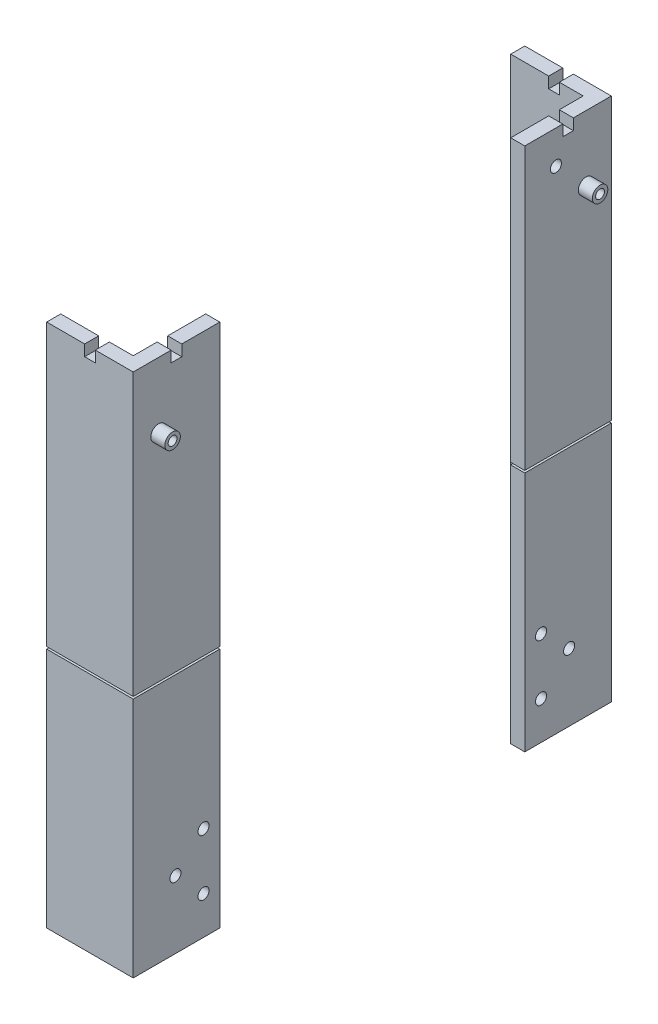
from build123d import *

# Parameters (mm, degrees)
SKETCH1_W                   = 32.730904613
SKETCH1_H                   = 237
BOSS_EXTRUDE1_DEPTH         = 6.35
SKETCH2_W                   = 39.08
SKETCH2_H                   = 237
BOSS_EXTRUDE3_DEPTH         = 6.35
SKETCH27_W                  = 4.8
SKETCH27_H                  = 5
LOCKING_MECHANISM_CUT_DEPTH = 6.35
SKETCH28_R                  = 2.5
BRACKET_BOLT_HOLES_DEPTH    = 6.35
F_1_MM_SPLIT_REACH          = 244.42
SKETCH29_W                  = 39.08
SKETCH29_H                  = 1
SKETCH32_R                  = 3.5
LOCKING_MOUNT_DEPTH         = 6.35
SKETCH33_R                  = 2
M4_SCREW_HOLE_DEPTH         = 6.35
SKETCH35_R                  = 2.5
CUT_EXTRUDE2_DEPTH          = 6.35


with BuildPart() as part:
    # Sketch1 → Boss-Extrude1 (new body)
    with BuildSketch(Plane.XY):
        with Locations((-16.365452306, 118.5)):
            Rectangle(SKETCH1_W, SKETCH1_H)
    extrude(amount=BOSS_EXTRUDE1_DEPTH)

    # Sketch2 → Boss-Extrude3 (add)
    with BuildSketch(Plane(origin=(0, 0, 0), x_dir=(0, 0, -1), z_dir=(1, 0, 0))):
        with Locations((13.19, 118.5)):
            Rectangle(SKETCH2_W, SKETCH2_H)
    extrude(amount=BOSS_EXTRUDE3_DEPTH)

    # Sketch27 → Locking_Mechanism_Cut (cut)
    with BuildSketch(Plane(origin=(6.35, 0, 0), x_dir=(0, 0, -1), z_dir=(1, 0, 0))):
        with Locations((13.180415796, 234.5)):
            Rectangle(SKETCH27_W, SKETCH27_H)
    locking_mechanism_cut = extrude(amount=-LOCKING_MECHANISM_CUT_DEPTH, mode=Mode.SUBTRACT)

    # Sketch28 → Bracket Bolt Holes (cut)
    with BuildSketch(Plane(origin=(6.35, 0, 0), x_dir=(0, 0, -1), z_dir=(1, 0, 0))):
        with Locations((25.4, 42.545)):
            Circle(SKETCH28_R)
        with Locations((25.4, 17.145)):
            Circle(SKETCH28_R)
        with Locations((12.7, 30.48)):
            Circle(SKETCH28_R)
    extrude(amount=-BRACKET_BOLT_HOLES_DEPTH, mode=Mode.SUBTRACT)

    # 1 mm split: up to this face of the body (flat: up to its plane)
    f_1_mm_split_end = Plane(part.part.faces().sort_by_distance((-32.730904613, 118.5, 3.175))[0])
    # Sketch29 → 1 mm split (cut, up to the picked face)
    with BuildSketch(Plane(origin=(6.35, 0, 0), x_dir=(0, 0, -1), z_dir=(1, 0, 0)), mode=Mode.PRIVATE) as f_1_mm_split_sk1:
        with Locations((13.19, 109.586886099)):
            Rectangle(SKETCH29_W, SKETCH29_H)
    f_1_mm_split_tool1 = split(extrude(f_1_mm_split_sk1.sketch, amount=-F_1_MM_SPLIT_REACH, mode=Mode.PRIVATE), bisect_by=f_1_mm_split_end, keep=Keep.BOTH, mode=Mode.PRIVATE)
    add(f_1_mm_split_tool1.solids().sort_by(Axis((6.35, 109.586886, -13.19), (-1, 0, 0)))[0], mode=Mode.SUBTRACT)


with BuildPart() as f_1_mm_split_piece_1:
    # of the separate pieces the step leaves, piece 1, a body of its own (f_1_mm_split_pieces)
    add(part.part.solids().sort_by_distance((-32.730904613, 110.086886099, 0))[0])

    # LockingMechanismMirror: Locking_Mechanism_Cut across plane
    add(locking_mechanism_cut.mirror(Plane(origin=(0, 0, 0), x_dir=(0.7071067811865465, 0, 0.7071067811865486), z_dir=(0.7071067811865488, 0, -0.7071067811865464))), mode=Mode.SUBTRACT)


with BuildPart() as f_1_mm_split_piece_2:
    # of the separate pieces the step leaves, piece 2, a body of its own (f_1_mm_split_pieces)
    add(part.part.solids().sort_by_distance((-32.730904613, 0, 0))[0])


with BuildPart() as body_3:
    # Sketch32 → Locking Mount (new body)
    with BuildSketch(Plane(origin=(6.35, 0, 0), x_dir=(0, 0, -1), z_dir=(1, 0, 0))):
        with Locations((5.08, 207.536)):
            Circle(SKETCH32_R)
    extrude(amount=LOCKING_MOUNT_DEPTH)

    # Sketch33 → M4 Screw Hole (cut)
    with BuildSketch(Plane(origin=(12.7, 0, 0), x_dir=(0, 0, -1), z_dir=(1, 0, 0))):
        with Locations((5.08, 207.536)):
            Circle(SKETCH33_R)
    extrude(amount=-M4_SCREW_HOLE_DEPTH, mode=Mode.SUBTRACT)


with BuildPart() as body_4:
    # Mirror2: mirrored copy
    add(f_1_mm_split_piece_1.part.mirror(Plane(origin=(0, 0, -101.6), x_dir=(1, 0, 0), z_dir=(0, 0, -1))))

    # Sketch35 → Cut-Extrude2 (cut)
    with BuildSketch(Plane.ZY):
        with Locations((-184.560987757, 222)):
            Circle(SKETCH35_R)
    extrude(amount=-CUT_EXTRUDE2_DEPTH, mode=Mode.SUBTRACT)


with BuildPart() as body_5:
    # Mirror2 2: mirrored copy
    add(f_1_mm_split_piece_2.part.mirror(Plane(origin=(0, 0, -101.6), x_dir=(1, 0, 0), z_dir=(0, 0, -1))))


with BuildPart() as body_6:
    # Mirror2 3: mirrored copy
    add(body_3.part.mirror(Plane(origin=(0, 0, -101.6), x_dir=(1, 0, 0), z_dir=(0, 0, -1))))


solid = Compound([f_1_mm_split_piece_1.part, f_1_mm_split_piece_2.part, body_3.part, body_4.part, body_5.part, body_6.part])
